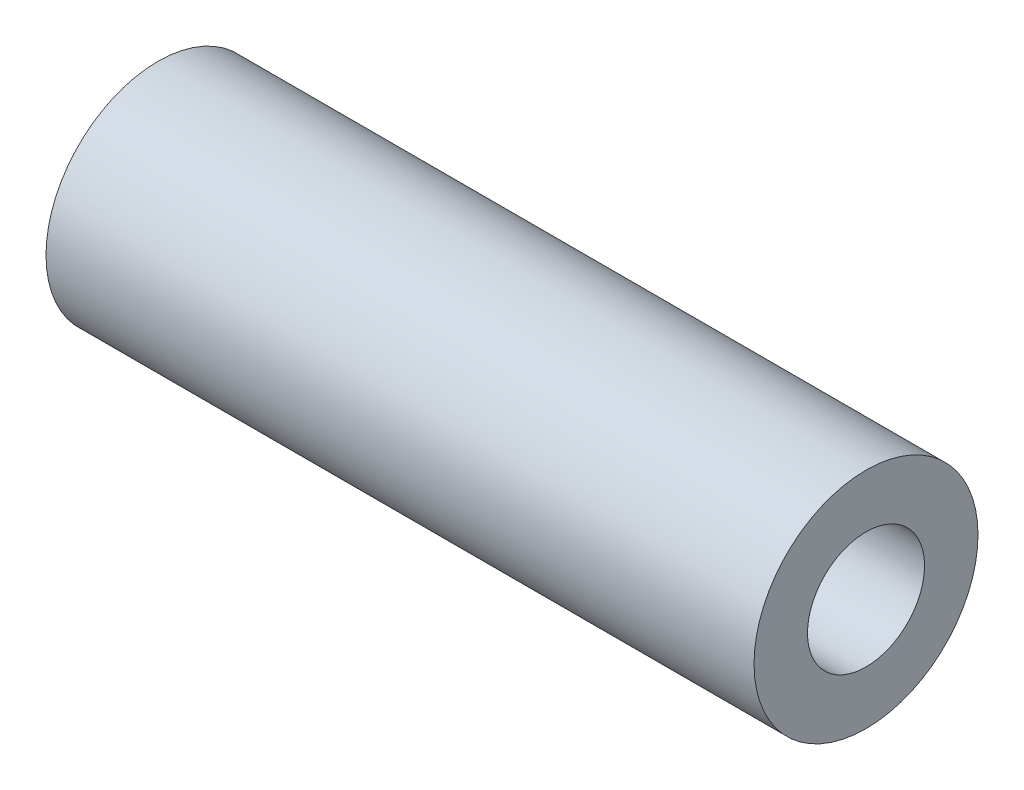
from build123d import *

# Parameters (mm, degrees)
SKETCH1_R           = 4.7625
SKETCH1_R_2         = 2.4892
BOSS_EXTRUDE1_DEPTH = 15.05585


with BuildPart() as part:
    # Sketch1 → Boss-Extrude1 (new, symmetric)
    with BuildSketch(Plane(origin=(0, 0, 0), x_dir=(0, 0, -1), z_dir=(1, 0, 0))):
        Circle(SKETCH1_R)
        Circle(SKETCH1_R_2, mode=Mode.SUBTRACT)
    extrude(amount=BOSS_EXTRUDE1_DEPTH, both=True)


solid = part.part
